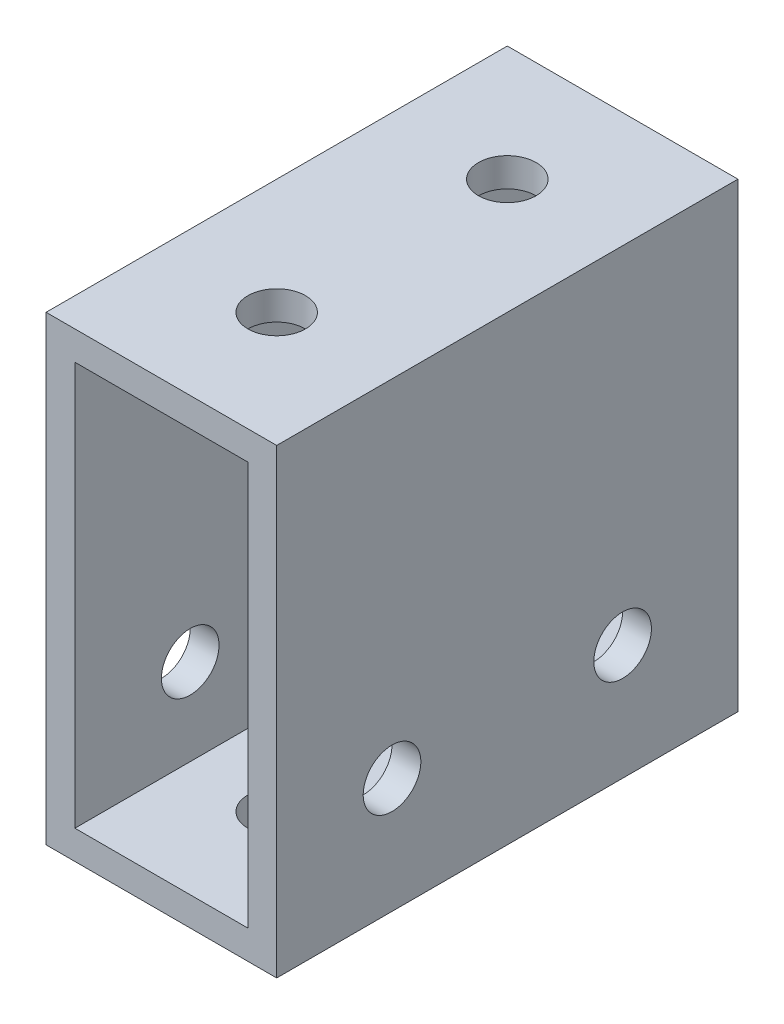
from build123d import *

# Parameters (mm, degrees)
SKETCH1_W           = 25.4
SKETCH1_H           = 50.8
SKETCH1_W_2         = 19.05
SKETCH1_H_2         = 44.45
BOSS_EXTRUDE1_DEPTH = 50.8
SKETCH2_R           = 3.175
CUT_EXTRUDE1_DEPTH  = 50.8
SKETCH3_R           = 3.175
CUT_EXTRUDE2_DEPTH  = 50.8


with BuildPart() as part:
    # Sketch1 → Boss-Extrude1 (new body)
    with BuildSketch(Plane.XY):
        with Locations((12.7, 25.4)):
            Rectangle(SKETCH1_W, SKETCH1_H)
        with Locations((12.7, 25.4)):
            Rectangle(SKETCH1_W_2, SKETCH1_H_2, mode=Mode.SUBTRACT)
    extrude(amount=BOSS_EXTRUDE1_DEPTH)

    # Sketch2 → Cut-Extrude1 (cut)
    with BuildSketch(Plane.XZ):
        with Locations(Location((12.7, 38.1, 0), (0, 0, 270))):
            Circle(SKETCH2_R)
        with Locations(Location((12.7, 12.7, 0), (0, 0, 270))):
            Circle(SKETCH2_R)
    extrude(amount=-CUT_EXTRUDE1_DEPTH, mode=Mode.SUBTRACT)

    # Sketch3 → Cut-Extrude2 (cut)
    with BuildSketch(Plane.ZY):
        with Locations((38.1, 12.7)):
            Circle(SKETCH3_R)
        with Locations((12.7, 12.7)):
            Circle(SKETCH3_R)
    extrude(amount=-CUT_EXTRUDE2_DEPTH, mode=Mode.SUBTRACT)


solid = part.part
